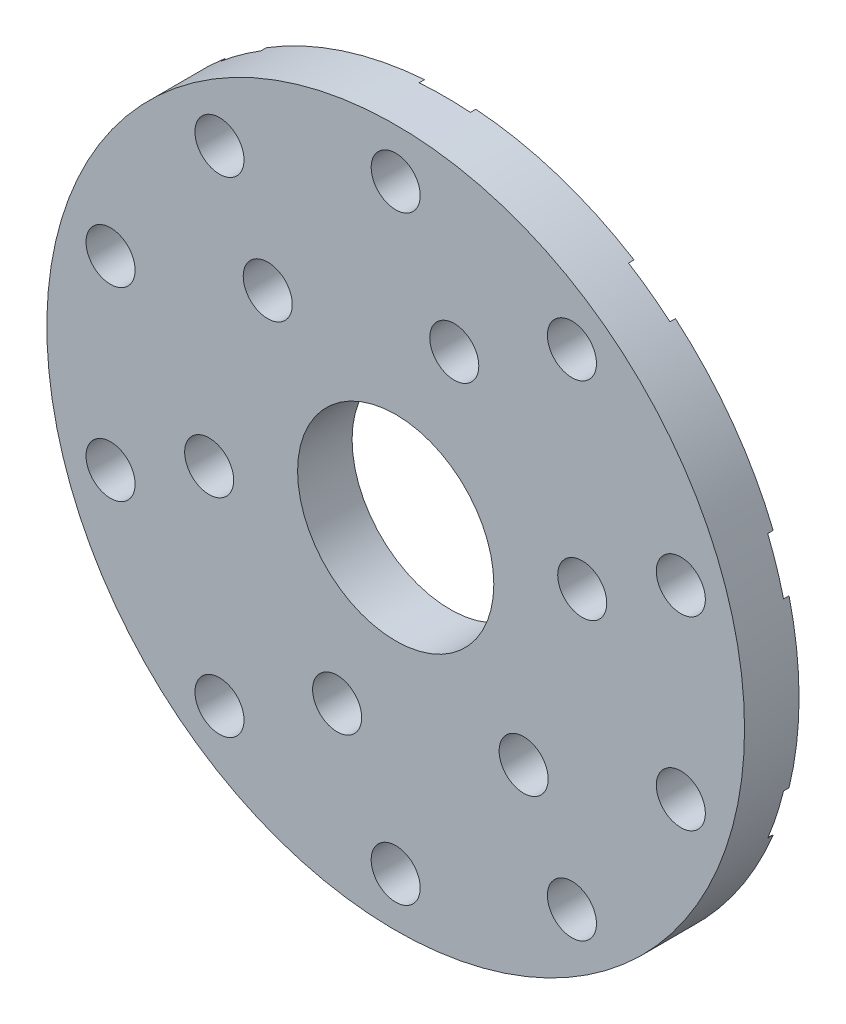
from build123d import *

# Parameters (mm, degrees)
SKETCH_1_R               = 32
EXTRUDE_1_DEPTH          = 5
CUT_EXTRUDE_1_REACH      = 47.53
SKETCH_3_R               = 9
PATTERN_CIRCULAR_1_COUNT = 10
PATTERN_CIRCULAR_2_COUNT = 6


with BuildPart() as part:
    # 草图1 → 凸台-拉伸1 (new body)
    with BuildSketch(Plane.XY):
        Circle(SKETCH_1_R)
    extrude(amount=EXTRUDE_1_DEPTH)

    # 草图3 → 切除-拉伸1 (cut, up to next)
    with BuildSketch(Plane(origin=(0, 0, 0), x_dir=(-1, 0, 0), z_dir=(0, 0, -1)), mode=Mode.PRIVATE) as cut_extrude_1_sk1:
        Circle(SKETCH_3_R)
    cut_extrude_1_tool1 = extrude(cut_extrude_1_sk1.sketch, amount=-CUT_EXTRUDE_1_REACH, mode=Mode.PRIVATE) & part.part
    add(cut_extrude_1_tool1.solids().sort_by_distance((0, 0, 0))[0], mode=Mode.SUBTRACT)

    # 草图5 → 打孔尺寸(%根据六角头螺)栓 全螺纹的类型1 (revolve, cut)
    with BuildSketch(Plane(origin=(0, 27.5, 0), x_dir=(0, 1, 0), z_dir=(1, 0, 0))):
        Polygon((0, 0), (0, 8.351936393), (2.25, 7), (2.25, 0.5), (5, 0.5), (5, 0), align=None)
    hole_wizard_1 = revolve(axis=Axis((0, 27.5, -6.35), (0, 0, 1)), mode=Mode.SUBTRACT)

    # 阵列(圆周)1: 打孔尺寸(%根据六角头螺)栓 全螺纹的类型1 ×10 about axis
    pattern_circular_1_axis = Axis((0, 0, 5), (0, 0, -1))
    for i in range(1, PATTERN_CIRCULAR_1_COUNT):
        add(hole_wizard_1.rotate(pattern_circular_1_axis, i * 360 / PATTERN_CIRCULAR_1_COUNT), mode=Mode.SUBTRACT)

    # 草图10 → 打孔尺寸(%根据六角头螺)栓 全螺纹的类型2 (revolve, cut)
    with BuildSketch(Plane(origin=(5.372375851, 16.654956551, 0), x_dir=(0, 1, 0), z_dir=(1, 0, 0))):
        Polygon((0, 0), (0, 7.951936393), (2.25, 6.6), (2.25, 0.5), (5, 0.5), (5, 0), align=None)
    hole_wizard_2 = revolve(axis=Axis((5.372375851, 16.654956551, -6.35), (0, 0, 1)), mode=Mode.SUBTRACT)

    # 阵列(圆周)2: 打孔尺寸(%根据六角头螺)栓 全螺纹的类型2 ×6 about axis
    pattern_circular_2_axis = Axis((0, 0, 5), (0, 0, -1))
    for i in range(1, PATTERN_CIRCULAR_2_COUNT):
        add(hole_wizard_2.rotate(pattern_circular_2_axis, i * 360 / PATTERN_CIRCULAR_2_COUNT), mode=Mode.SUBTRACT)


solid = part.part
